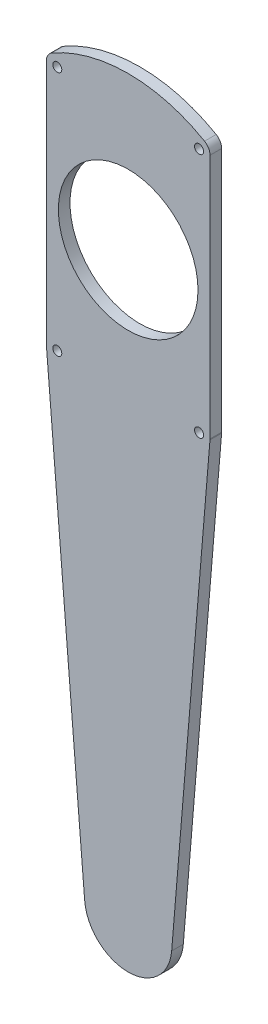
from build123d import *

# Parameters (mm, degrees)
SKETCH1_R           = 1.55
SKETCH1_R_2         = 24
BOSS_EXTRUDE1_DEPTH = 4
BOSS_EXTRUDE2_DEPTH = 4


with BuildPart() as part:
    # Sketch1 → Boss-Extrude1 (new body)
    with BuildSketch(Plane.XY):
        with BuildLine():
            ThreePointArc((-26.25, 45.466333699), (-27.622595264, 44.093738434), (-28.125, 42.218738434))
            Line((-28.125, 42.218738434), (-28.125, -42.218738434))
            ThreePointArc((-28.125, -42.218738434), (-28.12179062, -42.373851469), (-28.112167971, -42.528699002))
            ThreePointArc((-28.112167971, -42.528699002), (-27.542259342, -44.226465573), (-26.25, -45.466333699))
            ThreePointArc((-26.25, -45.466333699), (0, -52.5), (26.25, -45.466333699))
            ThreePointArc((26.25, -45.466333699), (27.542259342, -44.226465573), (28.112167971, -42.528699002))
            ThreePointArc((28.112167971, -42.528699002), (28.12179062, -42.373851469), (28.125, -42.218738434))
            Line((28.125, -42.218738434), (28.125, 42.218738434))
            ThreePointArc((28.125, 42.218738434), (27.622595264, 44.093738434), (26.25, 45.466333699))
            ThreePointArc((26.25, 45.466333699), (0, 52.5), (-26.25, 45.466333699))
        make_face()
        with Locations((-24.375, -42.218738434)):
            Circle(SKETCH1_R, mode=Mode.SUBTRACT)
        with Locations((-24.375, 42.218738434)):
            Circle(SKETCH1_R, mode=Mode.SUBTRACT)
        Circle(SKETCH1_R_2, mode=Mode.SUBTRACT)
        with Locations((24.375, -42.218738434)):
            Circle(SKETCH1_R, mode=Mode.SUBTRACT)
        with Locations((24.375, 42.218738434)):
            Circle(SKETCH1_R, mode=Mode.SUBTRACT)
    extrude(amount=BOSS_EXTRUDE1_DEPTH)

    # Sketch1<4> → Boss-Extrude2 (add)
    with BuildSketch(Plane.XY):
        with BuildLine():
            ThreePointArc((-26.25, -45.466333699), (-27.542259342, -44.226465573), (-28.112167971, -42.528699002))
            Line((-28.112167971, -42.528699002), (-14.948671886, -201.239842268))
            ThreePointArc((-14.948671886, -201.239842268), (0, -215), (14.948671886, -201.239842268))
            Line((14.948671886, -201.239842268), (28.112167971, -42.528699002))
            ThreePointArc((28.112167971, -42.528699002), (27.542259342, -44.226465573), (26.25, -45.466333699))
            ThreePointArc((26.25, -45.466333699), (0, -52.5), (-26.25, -45.466333699))
        make_face()
    extrude(amount=BOSS_EXTRUDE2_DEPTH)


solid = part.part
